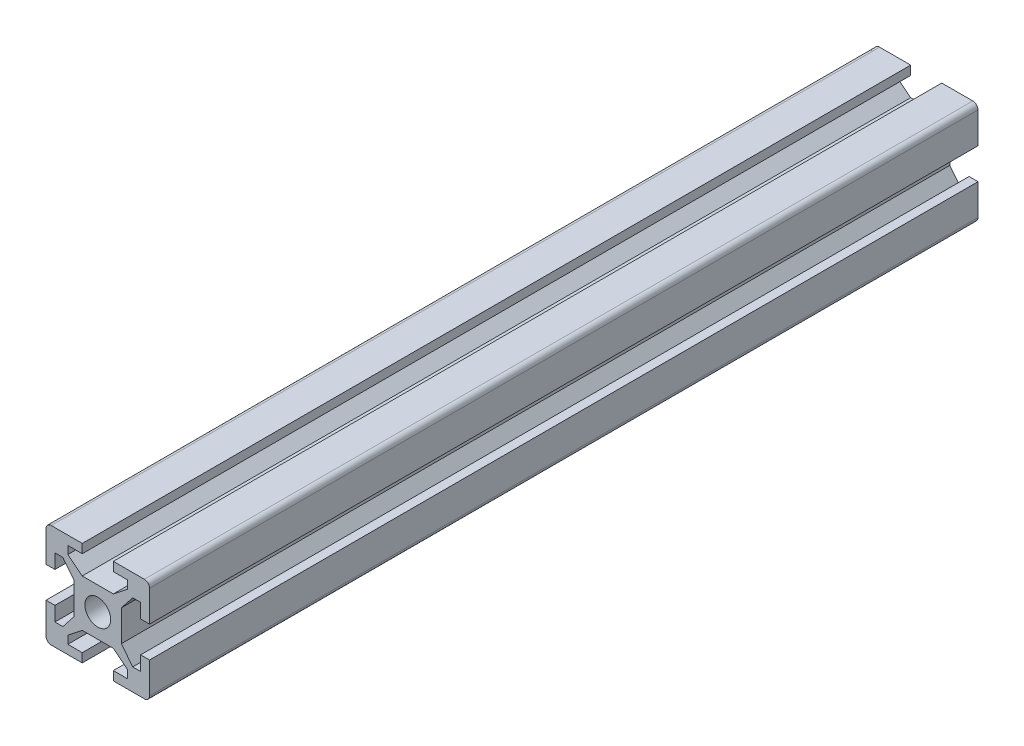
from build123d import *

# Parameters (mm, degrees)
BOSS_EXTRUDE1_DEPTH     = 80
CUT_EXTRUDE1_DEPTH      = 161.623784042
CUT_EXTRUDE1_DEPTH_BACK = 161.623784042
SKETCH2_R               = 2.5
FILLET1_R               = 1


with BuildPart() as part:
    # Sketch1 → Boss-Extrude1 (new, symmetric)
    with BuildSketch(Plane.XY):
        Polygon((-10, 10), (-3, 10), (-3, 8.272610059), (-5.783778863, 8.272610059), (-5.783778863, 6.747994248), (-3, 4.550753814), (3, 4.550753814), (5.783778863, 6.747994248), (5.783778863, 8.272610059), (3, 8.272610059), (3, 10), (10, 10), (10, 3), (8.272610059, 3), (8.272610059, 5.783778863), (6.747994248, 5.783778863), (4.55, 3.000595152), (4.55, -2.999404848), (6.747994248, -5.783778863), (8.272610059, -5.783778863), (8.272610059, -3), (10, -3), (10, -10), (3, -10), (3, -8.272610059), (5.783778863, -8.272610059), (5.783778863, -6.747994248), (2.999404848, -4.55), (-3.000595152, -4.55), (-5.783778863, -6.747994248), (-5.783778863, -8.272610059), (-3, -8.272610059), (-3, -10), (-10, -10), (-10, -3), (-8.272610059, -3), (-8.272610059, -5.783778863), (-6.747994248, -5.783778863), (-4.55, -3.000595152), (-4.55, 2.999404848), (-6.747994248, 5.783778863), (-8.272610059, 5.783778863), (-8.272610059, 3), (-10, 3), align=None)
    extrude(amount=BOSS_EXTRUDE1_DEPTH, both=True)

    # Sketch2 → Cut-Extrude1 (cut, two sides: drawn at the far end of the back side and taken through both)
    with BuildSketch(Plane.XY.offset(80).offset(-CUT_EXTRUDE1_DEPTH_BACK)):
        Circle(SKETCH2_R)
    extrude(amount=CUT_EXTRUDE1_DEPTH + CUT_EXTRUDE1_DEPTH_BACK, mode=Mode.SUBTRACT)

    # Fillet1
    fillet1_edges = [part.edges().sort_by_distance(p)[0] for p in [
        (-10, 10, 0),
        (10, 10, 0),
        (10, -10, 0),
        (-10, -10, 0),
    ]]
    fillet(fillet1_edges, radius=FILLET1_R)


solid = part.part
